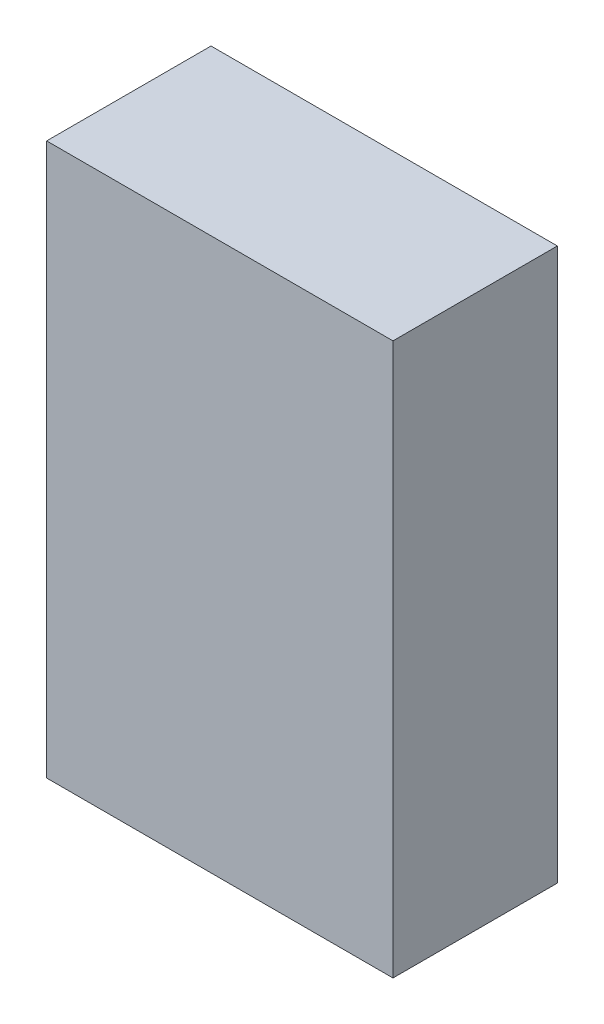
from build123d import *

# Parameters (mm, degrees)
SKETCH1_W           = 59
SKETCH1_H           = 94
SKETCH1_W_2         = 55
SKETCH1_H_2         = 90
EXTRUDE_THIN1_DEPTH = 26
SKETCH2_W           = 59
SKETCH2_H           = 94
BOSS_EXTRUDE1_DEPTH = 2


with BuildPart() as part:
    # Sketch1 → Extrude-Thin1 (new body)
    with BuildSketch(Plane.XY):
        with Locations((80.9055, -64.39)):
            Rectangle(SKETCH1_W, SKETCH1_H)
        with Locations((80.9055, -64.39)):
            Rectangle(SKETCH1_W_2, SKETCH1_H_2, mode=Mode.SUBTRACT)
    extrude(amount=EXTRUDE_THIN1_DEPTH)

    # Sketch2 → Boss-Extrude1 (add)
    with BuildSketch(Plane.XY.offset(26)):
        with Locations((80.9055, -64.39)):
            Rectangle(SKETCH2_W, SKETCH2_H)
    extrude(amount=BOSS_EXTRUDE1_DEPTH)


solid = part.part
